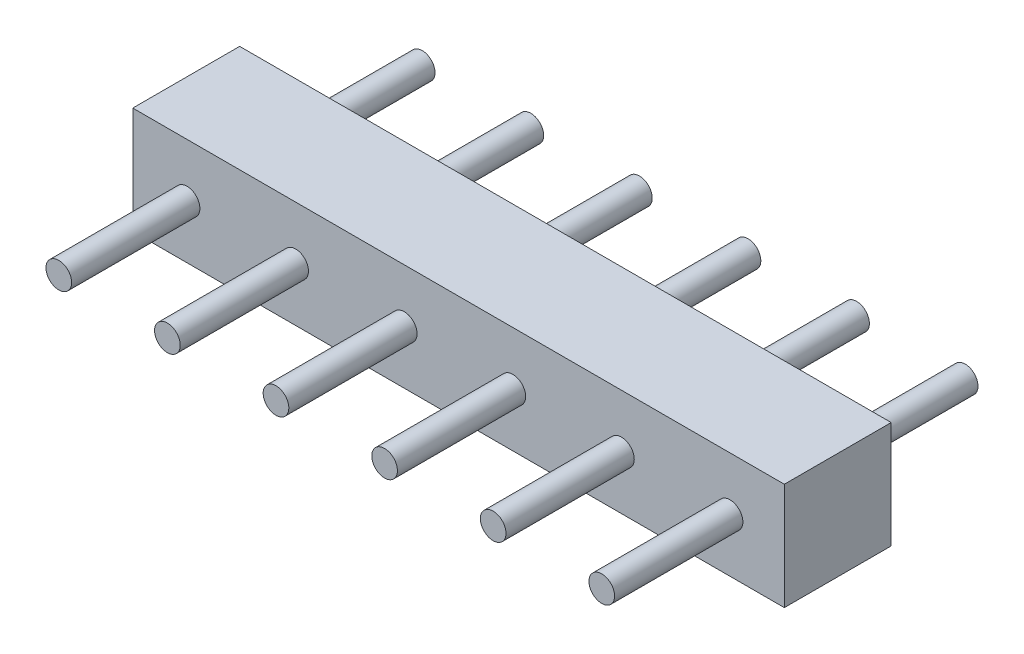
from build123d import *

# Parameters (mm, degrees)
SKETCH_1_W                 = 15.24
SKETCH_1_H                 = 2.5
EXTRUDE_1_DEPTH            = 2.5
EXTRUDE_START              = -5.5
SKETCH_2_R                 = 0.3
EXTRUDE_2_DEPTH            = 8.5
PATTERN_LINEAR_1_COUNT     = 4
PATTERN_LINEAR_1_PITCH     = 2.54
PATTERN_LINEAR_1_COL_COUNT = 3
PATTERN_LINEAR_1_COL_PITCH = 2.54


with BuildPart() as part:
    # 草图1 → 凸台-拉伸1 (new body)
    with BuildSketch(Plane.XY):
        with Locations((7.62, 1.25)):
            Rectangle(SKETCH_1_W, SKETCH_1_H)
    extrude(amount=EXTRUDE_1_DEPTH)

    # 草图2 → 凸台-拉伸2 (add)
    with BuildSketch(Plane.XY.offset(2.5).offset(EXTRUDE_START)):
        with Locations((6.35, 1.25)):
            Circle(SKETCH_2_R)
    extrude_2 = extrude(amount=EXTRUDE_2_DEPTH)

    # 阵列(线性)1: 凸台-拉伸2 ×4
    with Locations(*[(i * PATTERN_LINEAR_1_PITCH, 0, 0) for i in range(1, PATTERN_LINEAR_1_COUNT)]):
        add(extrude_2)

    # 阵列(线性)1 col: 凸台-拉伸2 ×3
    with Locations(*[(-i * PATTERN_LINEAR_1_COL_PITCH, 0, 0) for i in range(1, PATTERN_LINEAR_1_COL_COUNT)]):
        add(extrude_2)


solid = part.part
